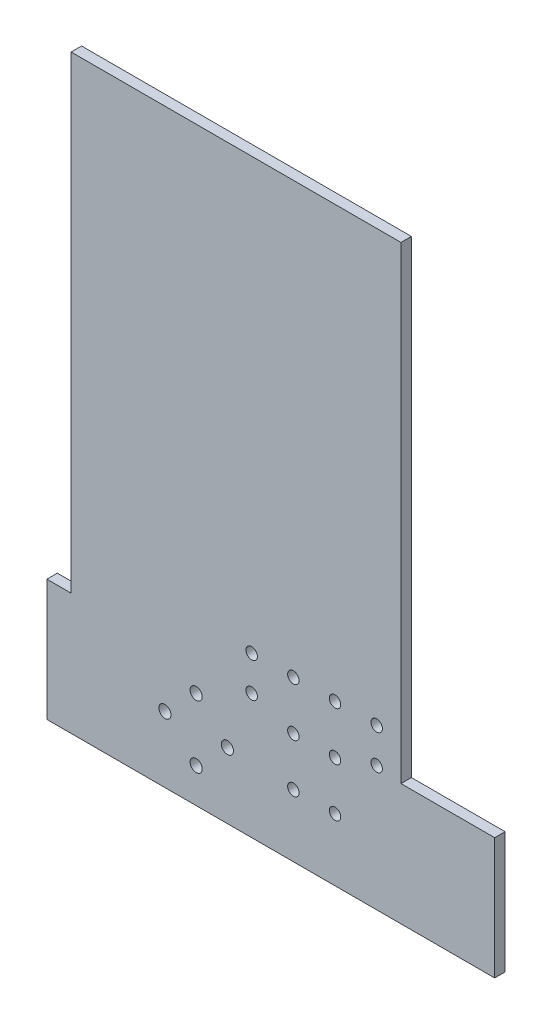
from build123d import *

# Parameters (mm, degrees)
SKETCH_1_W          = 105
SKETCH_1_H          = 35
SKETCH_1_R          = 1.75
EXTRUDE_1_DEPTH     = 3
SKETCH_3_W          = 24
SKETCH_3_H          = 35
EXTRUDE_2_DEPTH     = 3
SKETCH_4_W          = 95
SKETCH_4_H          = 135
EXTRUDE_3_DEPTH     = 3
SKETCH_2_R          = 1.65
CUT_EXTRUDE_1_DEPTH = 172.052623482


with BuildPart() as part:
    # 草图1 → 凸台-拉伸1 (new body)
    with BuildSketch(Plane.XY):
        with Locations((52.5, -17.5)):
            Rectangle(SKETCH_1_W, SKETCH_1_H)
        with Locations((19, -7)):
            Circle(SKETCH_1_R, mode=Mode.SUBTRACT)
        with Locations((10, -16)):
            Circle(SKETCH_1_R, mode=Mode.SUBTRACT)
        with Locations((19, -25)):
            Circle(SKETCH_1_R, mode=Mode.SUBTRACT)
        with Locations((28, -16)):
            Circle(SKETCH_1_R, mode=Mode.SUBTRACT)
    extrude(amount=EXTRUDE_1_DEPTH)

    # 草图3 → 凸台-拉伸2 (add)
    with BuildSketch(Plane.XY.offset(3)):
        with Locations((-12, -17.5)):
            Rectangle(SKETCH_3_W, SKETCH_3_H)
    extrude(amount=-EXTRUDE_2_DEPTH)

    # 草图4 → 凸台-拉伸3 (add)
    with BuildSketch(Plane.XY.offset(3)):
        with Locations((30.5, 67.5)):
            Rectangle(SKETCH_4_W, SKETCH_4_H)
    extrude(amount=-EXTRUDE_3_DEPTH)

    # 草图2 → 切除-拉伸1 (cut, through all)
    with BuildSketch(Plane.XY.offset(3)):
        with Locations((47, -3)):
            Circle(SKETCH_2_R)
        with Locations((59, -3)):
            Circle(SKETCH_2_R)
        with Locations((47, 11)):
            Circle(SKETCH_2_R)
        with Locations((59, 11)):
            Circle(SKETCH_2_R)
        with Locations((71, 11)):
            Circle(SKETCH_2_R)
        with Locations((35, 11)):
            Circle(SKETCH_2_R)
        with Locations((35, 1)):
            Circle(SKETCH_2_R)
        with Locations((71, 1)):
            Circle(SKETCH_2_R)
        with Locations((47, -17)):
            Circle(SKETCH_2_R)
        with Locations((59, -17)):
            Circle(SKETCH_2_R)
    extrude(amount=-CUT_EXTRUDE_1_DEPTH, mode=Mode.SUBTRACT)


solid = part.part
